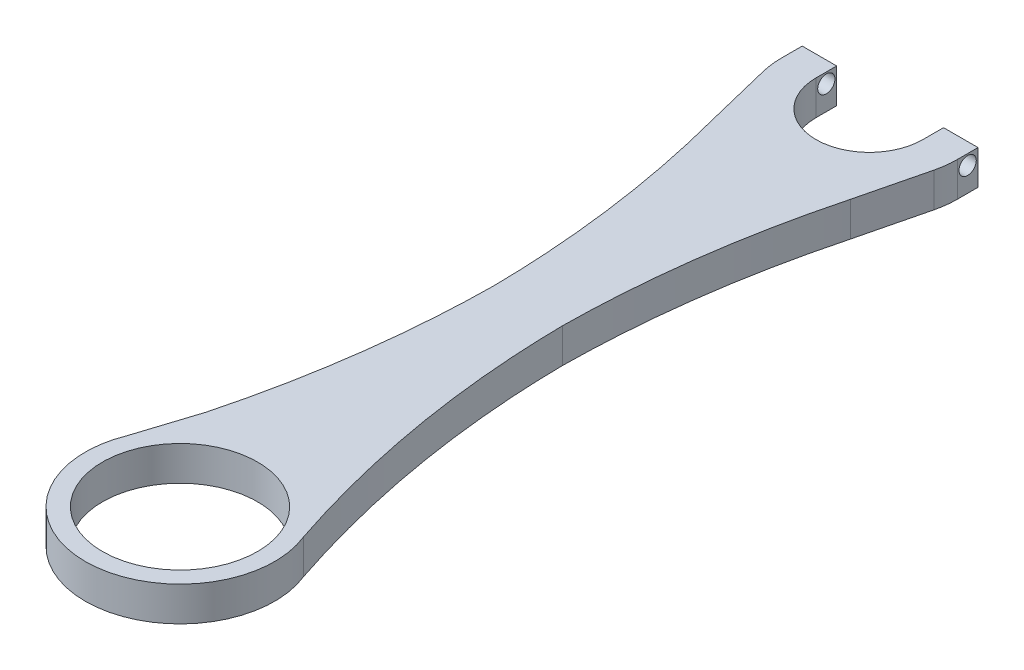
from build123d import *

# Parameters (mm, degrees)
BOSS_EXTRUDE1_DEPTH   = 10
SKETCH1_R             = 22.5
BOSS_EXTRUDE1_2_DEPTH = 10
BOSS_EXTRUDE6_DEPTH   = 10
SKETCH4_R             = 2.5
CUT_EXTRUDE1_DEPTH    = 234.806009457


with BuildPart() as part:
    # Sketch1 → Boss-Extrude1 (new body)
    with BuildSketch(Plane(origin=(0, 0, 0), x_dir=(1, 0, 0), z_dir=(0, 1, 0))):
        with BuildLine():
            Line((-25.5, 6), (-25.5, 0))
            ThreePointArc((-25.5, 0), (-25.315717118, -3.06014163), (-24.765532016, -6.076053321))
            Line((-24.765532016, -6.076053321), (-20, -25.5))
            add(Edge.make_bspline(
                [(-20, -25.5), (-10.418058305, -61.939732527), (-10, -99)],
                knots=[0, 0, 0, 0.916388339, 0.916388339, 0.916388339], degree=2))
            Line((-10, -99), (0, -99))
            Line((0, -99), (0, -172.5))
            Line((0, -172.5), (10, -172.5))
            Line((10, -172.5), (10, -105.767954903))
            add(Edge.make_bspline(
                [(10, -99), (9.961856183, -102.381394532), (10, -105.767954903)],
                knots=[0.916388339, 0.916388339, 0.916388339, 1, 1, 1], degree=2))
            add(Edge.make_bspline(
                [(20, -25.5), (10.418058305, -61.939732527), (10, -99)],
                knots=[0, 0, 0, 0.916388339, 0.916388339, 0.916388339], degree=2))
            Line((20, -25.5), (24.765532016, -6.076053321))
            ThreePointArc((24.765532016, -6.076053321), (25.315717118, -3.06014163), (25.5, 0))
            Line((25.5, 0), (25.5, 6))
            Line((25.5, 6), (15.5, 6))
            Line((15.5, 6), (15.5, 0))
            ThreePointArc((15.5, 0), (0, -15.5), (-15.5, 0))
            Line((-15.5, 0), (-15.5, 6))
            Line((-15.5, 6), (-25.5, 6))
        make_face()
    extrude(amount=BOSS_EXTRUDE1_DEPTH)



with BuildPart() as body_2:
    # Sketch1 → Boss-Extrude1 2 (new body)
    with BuildSketch(Plane(origin=(0, 0, 0), x_dir=(1, 0, 0), z_dir=(0, 1, 0))):
        with BuildLine():
            Line((-10, -172.5), (-10, -99))
            add(Edge.make_bspline(
                [(-20, -172.5), (-10.418058305, -136.060267473), (-10, -99)],
                knots=[0, 0, 0, 0.916388339, 0.916388339, 0.916388339], degree=2))
            Line((-20, -172.5), (-25.5, -189.704369859))
            ThreePointArc((-25.5, -189.704369859), (15.380509925, -222.796708412), (0, -172.5))
            Line((0, -172.5), (-10, -172.5))
        make_face()
        with Locations(Location((0, -200, 0), (0, 0, 270))):
            Circle(SKETCH1_R, mode=Mode.SUBTRACT)
    extrude(amount=BOSS_EXTRUDE1_2_DEPTH)


with BuildPart() as part_1:
    add(part.part)

    add(body_2.part)  # Boss-Extrude6 merges body 2
    # Sketch3 → Boss-Extrude6 (add)
    with BuildSketch(Plane(origin=(0, 10, 0), x_dir=(1, 0, 0), z_dir=(0, 1, 0))):
        with BuildLine():
            ThreePointArc((0, -172.5), (5.087835239, -172.974753792), (10, -174.382623085))
            Line((10, -174.382623085), (10, -99))
            Line((10, -99), (-10, -99))
            Line((-10, -99), (-10, -172.5))
            Line((-10, -172.5), (0, -172.5))
        make_face()
        with BuildLine():
            Line((10, -99), (10, -174.382623085))
            ThreePointArc((10, -174.382623085), (19.332653234, -180.442430648), (25.5, -189.704369859))
            add(Edge.make_bspline(
                [(25.5, -189.704369859), (10.530956194, -144.964559023), (10, -99)],
                knots=[0, 0, 0, 0.931489523, 0.931489523, 0.931489523], degree=2))
        make_face()
    extrude(amount=-BOSS_EXTRUDE6_DEPTH)

    # Sketch4 → Cut-Extrude1 (cut, through all)
    with BuildSketch(Plane.ZY.offset(25.5)):
        with Locations((-3, 7)):
            Circle(SKETCH4_R)
    extrude(amount=-CUT_EXTRUDE1_DEPTH, mode=Mode.SUBTRACT)


solid = part_1.part
